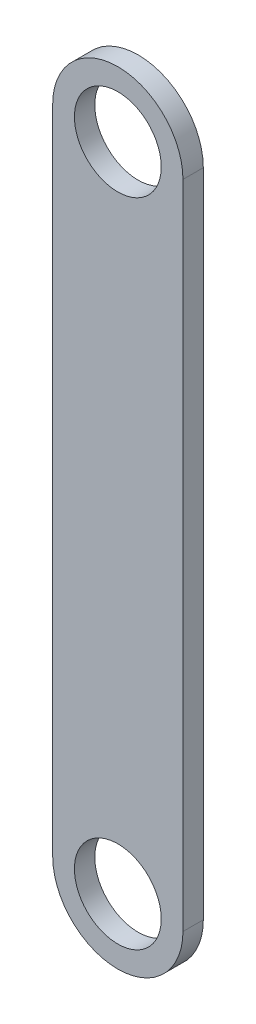
from build123d import *

# Parameters (mm, degrees)
SKETCH1_R           = 8.466666667
BOSS_EXTRUDE1_DEPTH = 3.96875
SCALE1_SCALE        = 0.75


with BuildPart() as part:
    # Sketch1 → Boss-Extrude1 (new body)
    with BuildSketch(Plane.XY):
        with BuildLine():
            Line((-12.7, 0), (-12.7, 127))
            ThreePointArc((-12.7, 127), (0, 139.7), (12.7, 127))
            Line((12.7, 127), (12.7, 0))
            ThreePointArc((12.7, 0), (0, -12.7), (-12.7, 0))
        make_face()
        Circle(SKETCH1_R, mode=Mode.SUBTRACT)
        with Locations((0, 127)):
            Circle(SKETCH1_R, mode=Mode.SUBTRACT)
    extrude(amount=BOSS_EXTRUDE1_DEPTH)


with BuildPart() as part_1:
    # Scale1: scaled about (0, 63.5, 1.984375)
    add(part.part.scale(SCALE1_SCALE).moved(Location((0, 15.875, 0.49609375))))


solid = part_1.part
